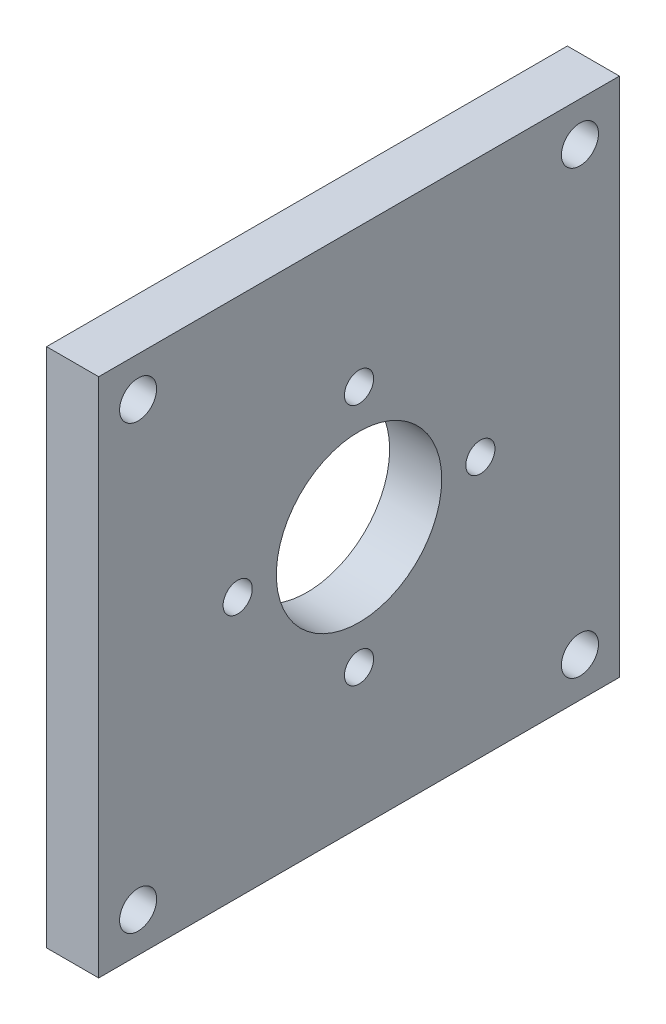
from build123d import *

# Parameters (mm, degrees)
SKETCH1_W                    = 31.75
SKETCH1_H                    = 31.75
BOSS_EXTRUDE1_DEPTH          = 3.175
X_0_397_DIAMETER_HOLE1_D     = 10.0838
X_0_397_DIAMETER_HOLE1_DEPTH = 12.7
X_0_397_DIAMETER_HOLE1_TIP   = 3.029479155
CIRPATTERN1_COUNT            = 4
CIRPATTERN2_COUNT            = 4


with BuildPart() as part:
    # Sketch1 → Boss-Extrude1 (new body)
    with BuildSketch(Plane(origin=(0, 0, 0), x_dir=(0, 0, -1), z_dir=(1, 0, 0))):
        Rectangle(SKETCH1_W, SKETCH1_H)
    extrude(amount=BOSS_EXTRUDE1_DEPTH)

    # X (0.397) Diameter Hole1
    with Locations(Plane(origin=(3.175, 0, 0), x_dir=(0, 0, -1), z_dir=(1, 0, 0))):
        with Locations((0, 0)):
            Hole(X_0_397_DIAMETER_HOLE1_D / 2, depth=X_0_397_DIAMETER_HOLE1_DEPTH)
            with Locations((0, 0, -(X_0_397_DIAMETER_HOLE1_DEPTH + X_0_397_DIAMETER_HOLE1_TIP / 2))):  # 118° drill point
                Cone(0, X_0_397_DIAMETER_HOLE1_D / 2, X_0_397_DIAMETER_HOLE1_TIP, mode=Mode.SUBTRACT)

    # Sketch4 → #2-56 Tapped Hole1 (revolve, cut)
    with BuildSketch(Plane(origin=(3.175, 7.4, 0), x_dir=(0, 0, -1), z_dir=(0, 1, 0))):
        Polygon((0, 0), (0, 7.13816509), (0.889, 6.604), (0.889, 0), align=None)
    f_2_56_tapped_hole1 = revolve(axis=Axis((9.525, 7.4, 0), (-1, 0, 0)), mode=Mode.SUBTRACT)

    # CirPattern1: #2-56 Tapped Hole1 ×4 about axis
    cirpattern1_axis = Axis((0, 0, 0), (1, 0, 0))
    for i in range(1, CIRPATTERN1_COUNT):
        add(f_2_56_tapped_hole1.rotate(cirpattern1_axis, i * 360 / CIRPATTERN1_COUNT), mode=Mode.SUBTRACT)

    # Sketch6 → #4-40 Tapped Hole1 (revolve, cut)
    with BuildSketch(Plane(origin=(3.175, 13.470384182, 13.470384182), x_dir=(0, 0, -1), z_dir=(0, 1, 0))):
        Polygon((0, 0), (0, 9.569152758), (1.1303, 8.89), (1.1303, 0), align=None)
    f_4_40_tapped_hole1 = revolve(axis=Axis((9.525, 13.470384182, 13.470384182), (-1, 0, 0)), mode=Mode.SUBTRACT)

    # CirPattern2: #4-40 Tapped Hole1 ×4 about axis
    cirpattern2_axis = Axis((0, 0, 0), (1, 0, 0))
    for i in range(1, CIRPATTERN2_COUNT):
        add(f_4_40_tapped_hole1.rotate(cirpattern2_axis, i * 360 / CIRPATTERN2_COUNT), mode=Mode.SUBTRACT)


solid = part.part
